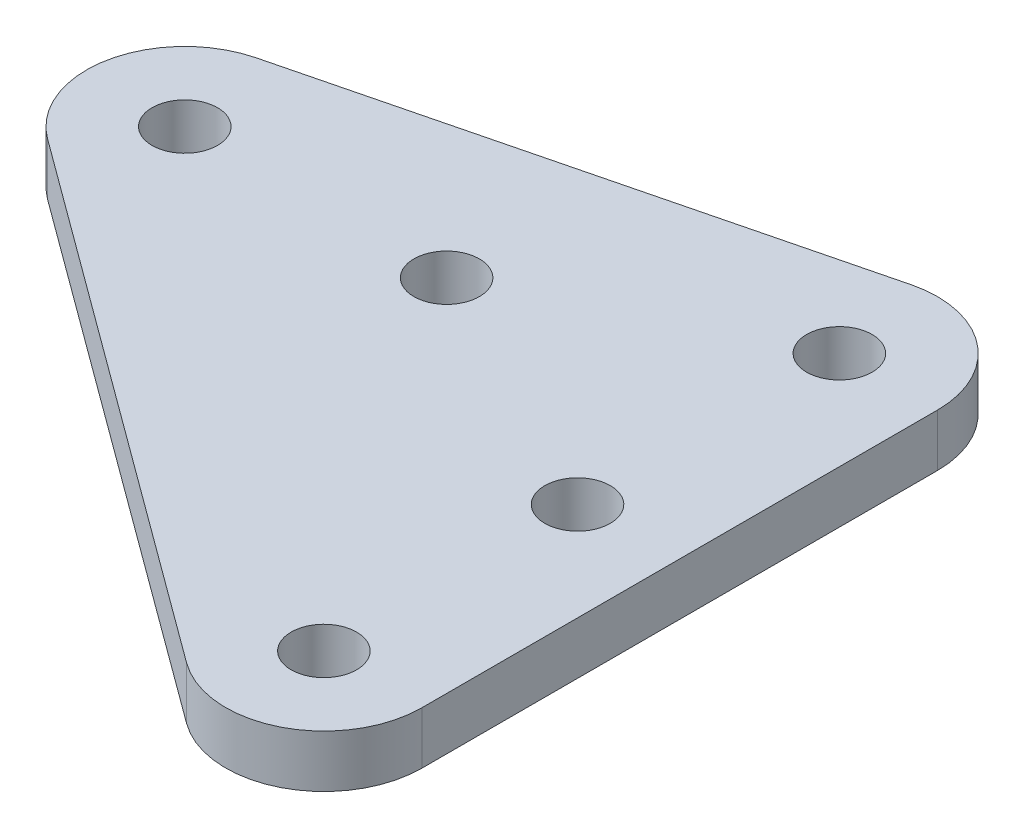
from build123d import *

# Parameters (mm, degrees)
SKETCH1_R           = 2.5
BOSS_EXTRUDE1_DEPTH = 4


with BuildPart() as part:
    # Sketch1 → Boss-Extrude1 (new body)
    with BuildSketch(Plane(origin=(0, 0, 0), x_dir=(1, 0, 0), z_dir=(0, 1, 0))):
        with BuildLine():
            Line((-28.278974074, 16.963626091), (11.721025926, 26.963626091))
            ThreePointArc((11.721025926, 26.963626091), (18.155634684, 25.599098125), (21.040043114, 19.687557339))
            Line((21.040043114, 19.687557339), (21.040043114, -19.687557339))
            ThreePointArc((21.040043114, -19.687557339), (16.927889481, -26.378782712), (9.100710583, -25.732582292))
            Line((9.100710583, -25.732582292), (-30.899289417, 3.642532387))
            ThreePointArc((-30.899289417, 3.642532387), (-33.81893913, 11.1351002), (-28.278974074, 16.963626091))
        make_face()
        with Locations(Location((-26.459956886, 9.687557339, 0), (0, 0, 270))):
            Circle(SKETCH1_R, mode=Mode.SUBTRACT)
        with Locations(Location((-6.459956886, 9.687557339, 0), (0, 0, 270))):
            Circle(SKETCH1_R, mode=Mode.SUBTRACT)
        with Locations(Location((13.540043114, 19.687557339, 0), (0, 0, 270))):
            Circle(SKETCH1_R, mode=Mode.SUBTRACT)
        with Locations(Location((13.540043114, -0.312442661, 0), (0, 0, 90))):
            Circle(SKETCH1_R, mode=Mode.SUBTRACT)
        with Locations(Location((13.540043114, -19.687557339, 0), (0, 0, 270))):
            Circle(SKETCH1_R, mode=Mode.SUBTRACT)
    extrude(amount=BOSS_EXTRUDE1_DEPTH)


solid = part.part
